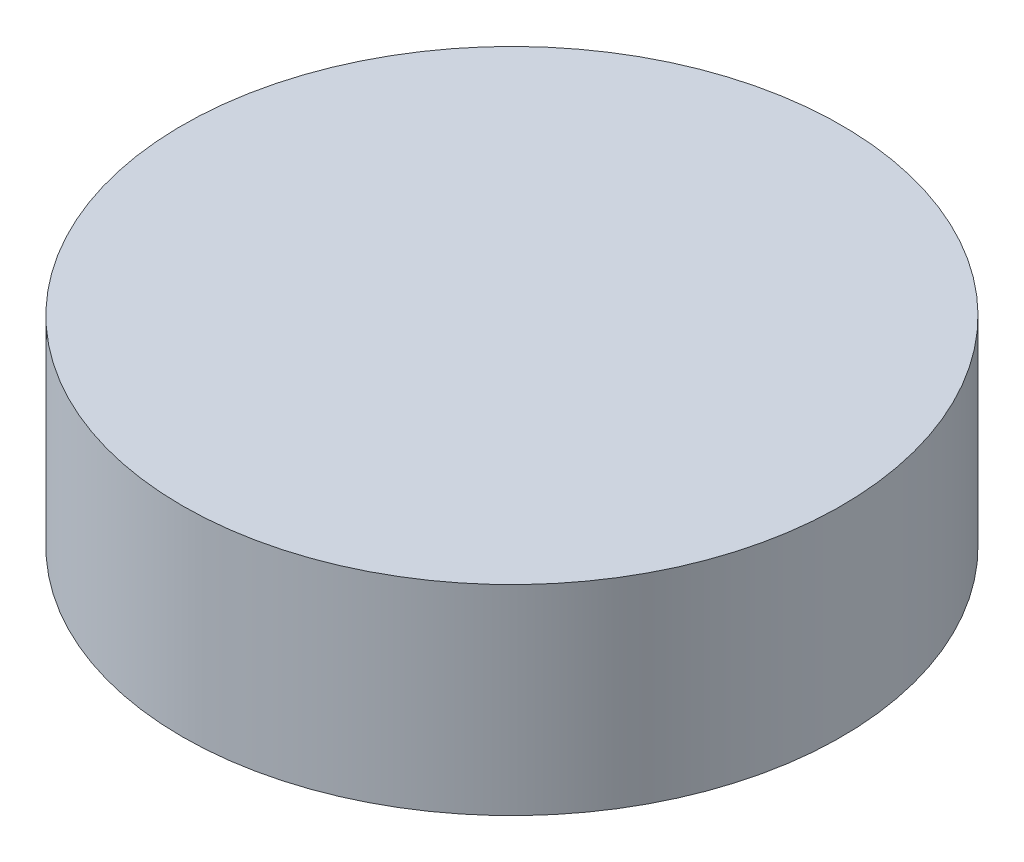
from build123d import *

# Parameters (mm, degrees)
SKETCH1_R           = 28
BOSS_EXTRUDE1_DEPTH = 17


with BuildPart() as part:
    # Sketch1 → Boss-Extrude1 (new body)
    with BuildSketch(Plane(origin=(0, 0, 0), x_dir=(1, 0, 0), z_dir=(0, 1, 0))):
        with Locations(Location((-28.14094114, -14.888521184, 0), (0, 0, 270))):
            Circle(SKETCH1_R)
    extrude(amount=BOSS_EXTRUDE1_DEPTH)


solid = part.part
